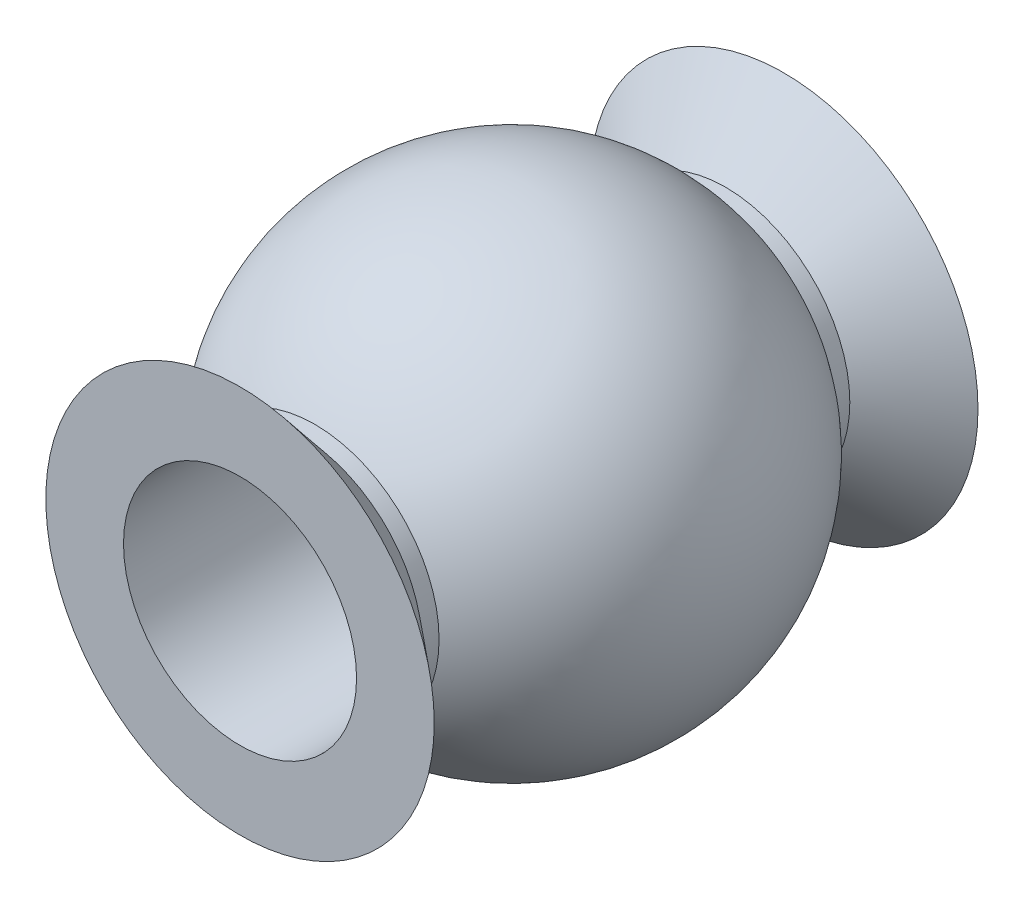
from build123d import *

# Parameters (mm, degrees)
SKETCH2_R          = 1.5
CUT_EXTRUDE1_DEPTH = 9.185352772


with BuildPart() as part:
    # Sketch1 → Revolve1 (revolve)
    with BuildSketch(Plane(origin=(0, 0, 0), x_dir=(1, 0, 0), z_dir=(0, 1, 0))):
        with BuildLine():
            Line((0, 0), (0, 7))
            Line((0, 7), (2.5, 7))
            Line((2.5, 7), (1.6, 6.25))
            Line((1.6, 6.25), (1.6, 6.037715508))
            ThreePointArc((1.6, 6.037715508), (3, 3.5), (1.6, 0.962284492))
            Line((1.6, 0.962284492), (1.6, 0.75))
            Line((1.6, 0.75), (2.5, 0))
            Line((2.5, 0), (0, 0))
        make_face()
    revolve(axis=Axis((0, 0, 0), (0, 0, -1)))

    # Sketch2 → Cut-Extrude1 (cut, through all)
    with BuildSketch(Plane.XY):
        Circle(SKETCH2_R)
    extrude(amount=-CUT_EXTRUDE1_DEPTH, mode=Mode.SUBTRACT)


solid = part.part
